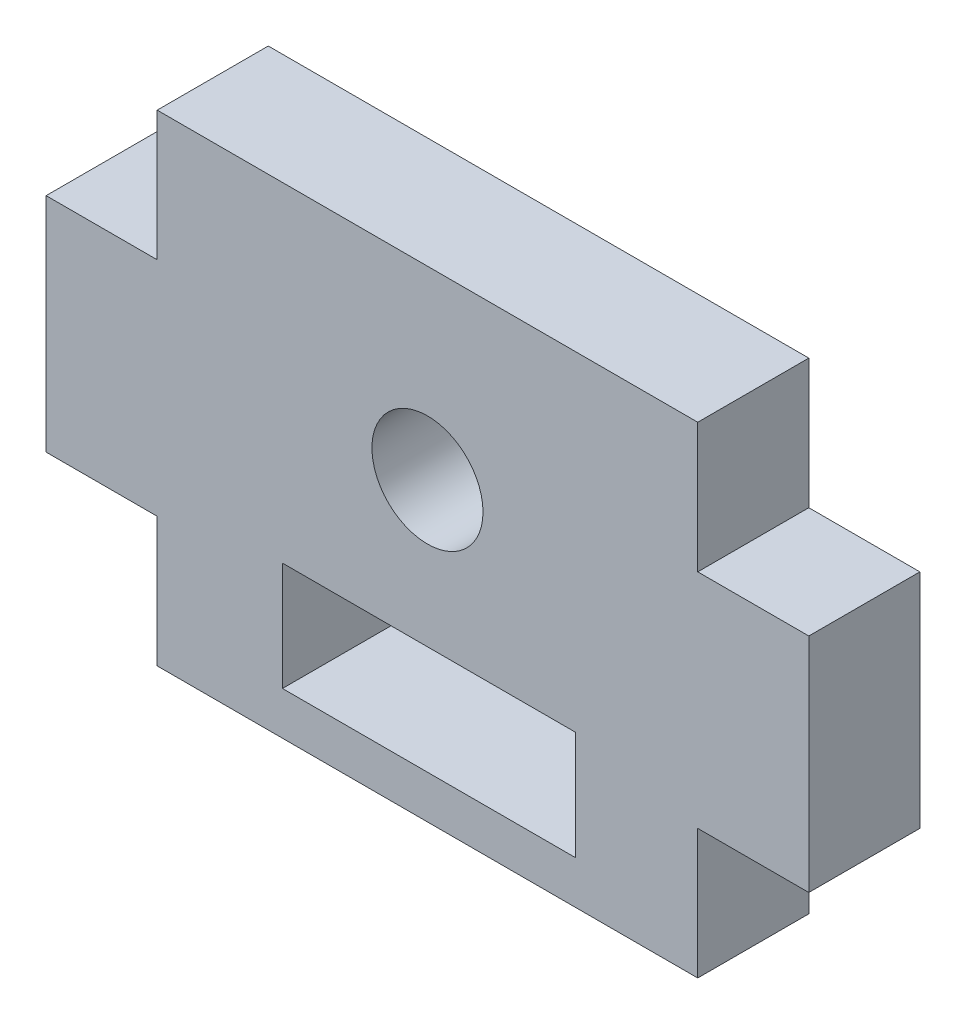
from build123d import *

# Parameters (mm, degrees)
CROQUIS1_W              = 14.6
CROQUIS1_H              = 13
CROQUIS1_W_2            = 3
CROQUIS1_H_2            = 6
SALIENTE_EXTRUIR1_DEPTH = 3
CROQUIS2_R              = 1.5
CROQUIS2_W              = 7.910028885
CROQUIS2_H              = 2.9332022
CORTAR_EXTRUIR1_DEPTH   = 10


with BuildPart() as part:
    # Croquis1 → Saliente-Extruir1 (new body)
    with BuildSketch(Plane.XY):
        Rectangle(CROQUIS1_W, CROQUIS1_H)
        with Locations((-8.8, 0)):
            Rectangle(CROQUIS1_W_2, CROQUIS1_H_2)
        with Locations((8.8, 0)):
            Rectangle(CROQUIS1_W_2, CROQUIS1_H_2)
    extrude(amount=SALIENTE_EXTRUIR1_DEPTH)

    # Croquis2 → Cortar-Extruir1 (cut)
    with BuildSketch(Plane.XY.offset(3)):
        with Locations((0, 1.5)):
            Circle(CROQUIS2_R)
        with Locations((0.038370941, -3.869685697)):
            Rectangle(CROQUIS2_W, CROQUIS2_H)
    extrude(amount=-CORTAR_EXTRUIR1_DEPTH, mode=Mode.SUBTRACT)


solid = part.part
